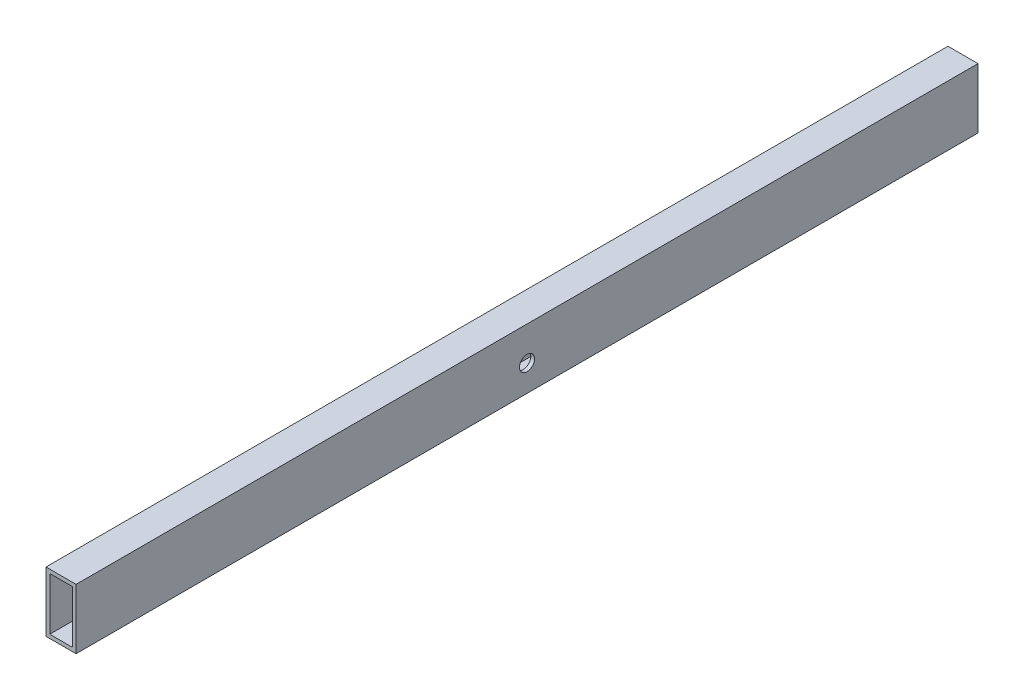
from build123d import *

# Parameters (mm, degrees)
SKETCH1_W           = 25.4
SKETCH1_H           = 50.8
SKETCH1_W_2         = 19.05
SKETCH1_H_2         = 44.45
BOSS_EXTRUDE1_DEPTH = 381
SKETCH2_R           = 6.35
CUT_EXTRUDE1_DEPTH  = 25.4


with BuildPart() as part:
    # Sketch1 → Boss-Extrude1 (new, symmetric)
    with BuildSketch(Plane.XY):
        with Locations((1.901454405, -7.699719174)):
            Rectangle(SKETCH1_W, SKETCH1_H)
        with Locations((1.901454405, -7.699719174)):
            Rectangle(SKETCH1_W_2, SKETCH1_H_2, mode=Mode.SUBTRACT)
    extrude(amount=BOSS_EXTRUDE1_DEPTH, both=True)

    # Sketch2 → Cut-Extrude1 (cut)
    with BuildSketch(Plane(origin=(14.601454405, 0, 0), x_dir=(0, 0, -1), z_dir=(1, 0, 0))):
        with Locations(Location((0, -10.874719174, 0), (0, 0, 90))):
            Circle(SKETCH2_R)
    extrude(amount=-CUT_EXTRUDE1_DEPTH, mode=Mode.SUBTRACT)


solid = part.part
